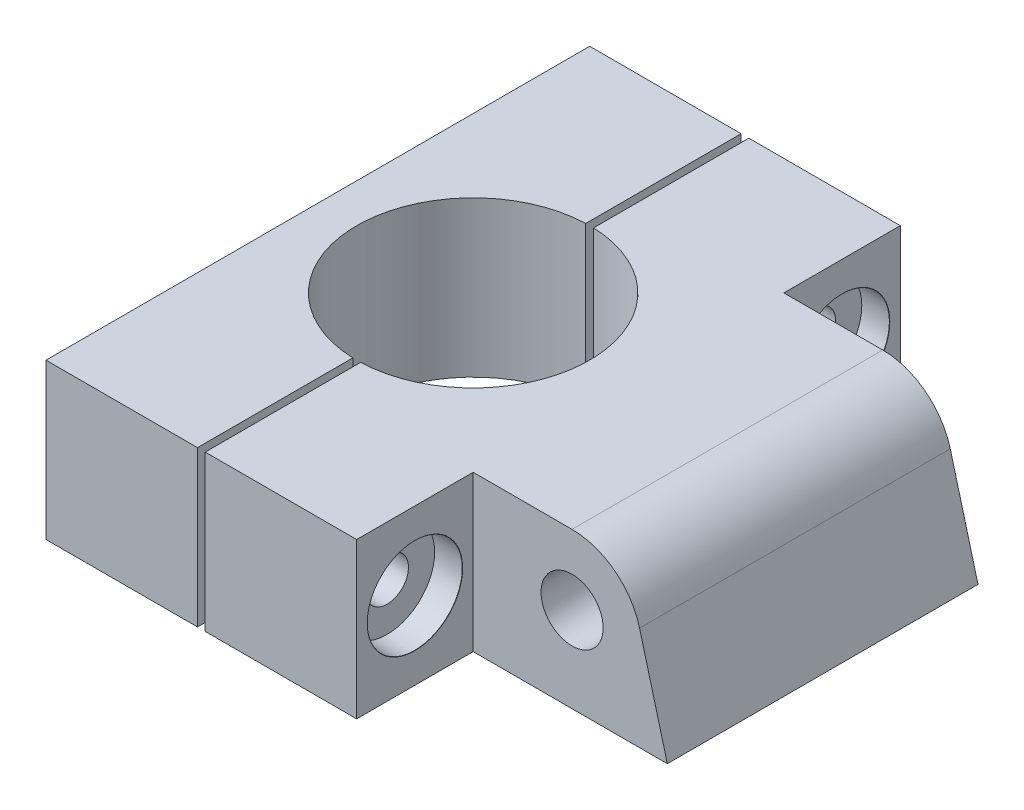
from build123d import *

# Parameters (mm, degrees)
SKETCH1_W                              = 40
SKETCH1_H                              = 20
BOSS_EXTRUDE2_DEPTH                    = 35
SKETCH1_3_R                            = 4
BOSS_EXTRUDE3_DEPTH                    = 20
CUT_EXTRUDE1_DEPTH                     = 61.415229868
CBORE_FOR_M5_HEX_HEAD_BOLT1_AT_2_COUNT = 2
CBORE_FOR_M5_HEX_HEAD_BOLT1_AT_2_PITCH = 55


with BuildPart() as part:
    # Sketch1 → Boss-Extrude2 (new, symmetric)
    with BuildSketch(Plane.XY):
        Rectangle(SKETCH1_W, SKETCH1_H)
    extrude(amount=BOSS_EXTRUDE2_DEPTH, both=True)

    # Sketch1<3> → Boss-Extrude3 (add, symmetric)
    with BuildSketch(Plane.XY):
        with BuildLine():
            Line((20, 10), (20, -10))
            Line((20, -10), (45, -10))
            Line((45, -10), (41.428405696, 3.329371406))
            ThreePointArc((41.428405696, 3.329371406), (38.213926121, 8.140180063), (32.73507326, 10))
            Line((32.73507326, 10), (20, 10))
        make_face()
        with Locations((32.73507326, 1)):
            Circle(SKETCH1_3_R, mode=Mode.SUBTRACT)
    extrude(amount=BOSS_EXTRUDE3_DEPTH, both=True)

    # Sketch2 → Cut-Extrude1 (cut, through all)
    with BuildSketch(Plane(origin=(0, 10, 0), x_dir=(1, 0, 0), z_dir=(0, 1, 0))):
        with BuildLine():
            Line((0.5, 35), (-0.5, 35))
            Line((-0.5, 35), (-0.5, 14.991664351))
            ThreePointArc((-0.5, 14.991664351), (-15, 0), (-0.5, -14.991664351))
            Line((-0.5, -14.991664351), (-0.5, -35))
            Line((-0.5, -35), (0.5, -35))
            Line((0.5, -35), (0.5, -14.991664351))
            ThreePointArc((0.5, -14.991664351), (15, 0), (0.5, 14.991664351))
            Line((0.5, 14.991664351), (0.5, 35))
        make_face()
    extrude(amount=-CUT_EXTRUDE1_DEPTH, mode=Mode.SUBTRACT)


with BuildPart() as cut_extrude1_piece_1:
    # of the separate pieces the step leaves, piece 1, a body of its own (cut_extrude1_pieces)
    add(part.part.solids().sort_by_distance((0.5, -10, -35))[0])


with BuildPart() as cut_extrude1_piece_2:
    # of the separate pieces the step leaves, piece 2, a body of its own (cut_extrude1_pieces)
    add(part.part.solids().sort_by_distance((-20, -10, 35))[0])


with BuildPart() as cbore_for_m5_hex_head_bolt1_tool:
    # Sketch8 → CBORE for M5 Hex Head Bolt1 (revolve)
    with BuildSketch(Plane(origin=(20, 0, 27.5), x_dir=(0, 0, -1), z_dir=(0, 1, 0))):
        Polygon((0, 0), (0, 40), (2.75, 40), (2.75, 3.58), (6.12, 3.58), (6.12, 0.025), (6.145, 0), align=None)
    cbore_for_m5_hex_head_bolt1 = revolve(axis=Axis((26.35, 0, 27.5), (-1, 0, 0)))


with BuildPart() as cut_extrude1_piece_1_1:
    add(cut_extrude1_piece_1.part)

    # CBORE for M5 Hex Head Bolt1: cut by cbore_for_m5_hex_head_bolt1_tool
    add(cbore_for_m5_hex_head_bolt1_tool.part, mode=Mode.SUBTRACT)


with BuildPart() as cut_extrude1_piece_2_1:
    add(cut_extrude1_piece_2.part)

    # CBORE for M5 Hex Head Bolt1: cut by cbore_for_m5_hex_head_bolt1_tool
    add(cbore_for_m5_hex_head_bolt1_tool.part, mode=Mode.SUBTRACT)


with BuildPart() as cbore_for_m5_hex_head_bolt1_at_2_tool:
    # CBORE for M5 Hex Head Bolt1 at 2: CBORE for M5 Hex Head Bolt1 ×2
    with Locations(*[(0, 0, -i * CBORE_FOR_M5_HEX_HEAD_BOLT1_AT_2_PITCH) for i in range(1, CBORE_FOR_M5_HEX_HEAD_BOLT1_AT_2_COUNT)]):
        add(cbore_for_m5_hex_head_bolt1)


with BuildPart() as cut_extrude1_piece_1_2:
    add(cut_extrude1_piece_1_1.part)

    # CBORE for M5 Hex Head Bolt1 at 2: cut by cbore_for_m5_hex_head_bolt1_at_2_tool
    add(cbore_for_m5_hex_head_bolt1_at_2_tool.part, mode=Mode.SUBTRACT)


with BuildPart() as cut_extrude1_piece_2_2:
    add(cut_extrude1_piece_2_1.part)

    # CBORE for M5 Hex Head Bolt1 at 2: cut by cbore_for_m5_hex_head_bolt1_at_2_tool
    add(cbore_for_m5_hex_head_bolt1_at_2_tool.part, mode=Mode.SUBTRACT)


solid = Compound([cut_extrude1_piece_1_2.part, cut_extrude1_piece_2_2.part])
